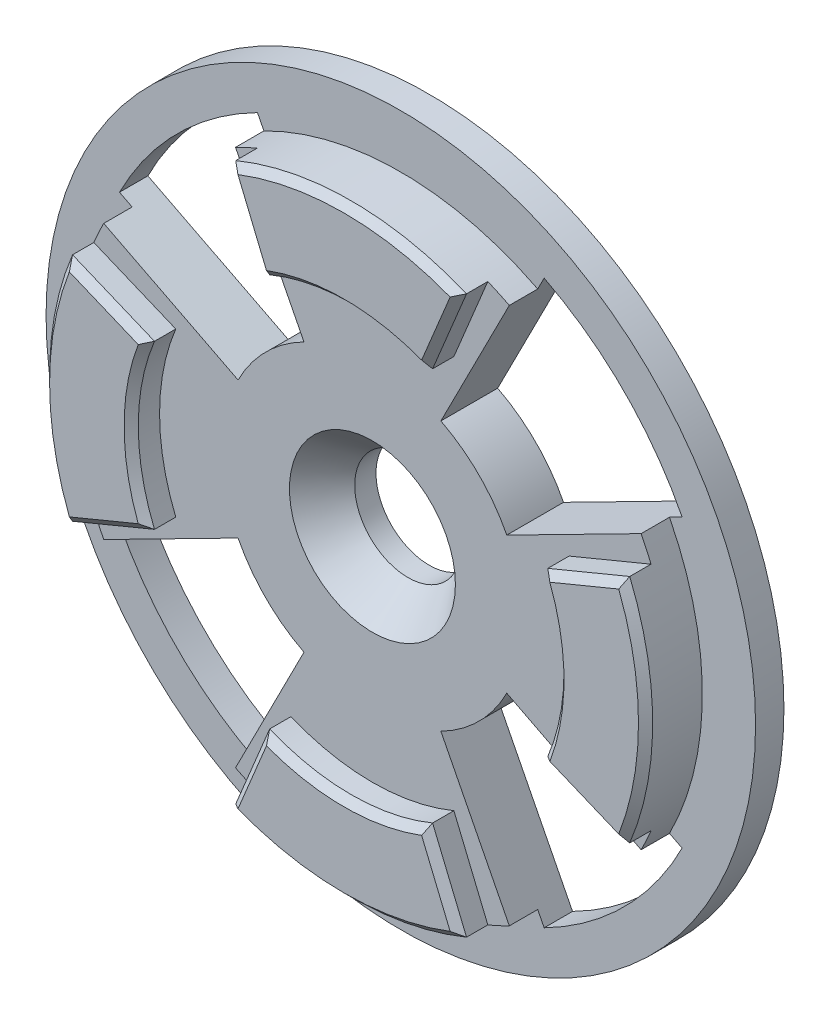
from build123d import *
from build123d.topology import SkipClean

# Parameters (mm, degrees)
SKETCH1_R                    = 10
BOSS_EXTRUDE1_DEPTH          = 0.8
SKETCH2_R                    = 1.1
CUT_EXTRUDE1_DEPTH           = 10
BOSS_EXTRUDE2_DEPTH          = 0.8
SKETCH4_R                    = 1.5
CUT_EXTRUDE2_DEPTH           = 10
CHAMFER1_SIZE                = 1
CHAMFER1_SIZE2               = 0.8391
SKETCH7_R                    = 1.1
BOSS_EXTRUDE3_DEPTH          = 0.8
BOSS_EXTRUDE4_DEPTH          = 0.8
CUT_EXTRUDE3_DEPTH           = 15.232357
CUT_EXTRUDE3_DEPTH_BACK      = 15.232357
SKETCH9_R                    = 0.755
CUT_EXTRUDE4_DEPTH           = 15.232357
CUT_EXTRUDE4_DEPTH_BACK      = 15.232357
SKETCH10_R                   = 1.5
CUT_EXTRUDE_THIN1_DEPTH      = 15.232357
CUT_EXTRUDE_THIN1_DEPTH_BACK = 0.8
BOSS_EXTRUDE5_DEPTH          = 0.8
SKETCH14_R                   = 0.755
CUT_EXTRUDE5_DEPTH           = 10
CHAMFER2_SIZE                = 0.2
CUT_EXTRUDE6_DEPTH           = 10


with BuildPart() as part:
    # Sketch1 → Boss-Extrude1 (new body)
    with BuildSketch(Plane.XY):
        Circle(SKETCH1_R)
    extrude(amount=BOSS_EXTRUDE1_DEPTH)

    # Sketch2 → Cut-Extrude1 (cut)
    with BuildSketch(Plane.XY.offset(0.8)):
        with Locations((0, -8)):
            Circle(SKETCH2_R)
    extrude(amount=-CUT_EXTRUDE1_DEPTH, mode=Mode.SUBTRACT)

    # Sketch3 → Boss-Extrude2 (add)
    with BuildSketch(Plane.XY.offset(0.8)):
        with BuildLine():
            ThreePointArc((1.097695, -8.428824), (0, 8.5), (-1.097695, -8.428824))
            ThreePointArc((-1.097695, -8.428824), (0, -6.821516), (1.097695, -8.428824))
        make_face()
    extrude(amount=BOSS_EXTRUDE2_DEPTH)

    # Sketch4 → Cut-Extrude2 (cut)
    with BuildSketch(Plane.XY.offset(1.6)):
        Circle(SKETCH4_R)
    extrude(amount=-CUT_EXTRUDE2_DEPTH, mode=Mode.SUBTRACT)

    # Chamfer1
    chamfer1_edges = [part.edges().sort_by_distance(p)[0] for p in [
        (-1.5, 0, 1.6),
    ]]
    chamfer1_side = [part.faces().sort_by_distance(p)[0] for p in [
        (-1.5, 0, 0.8),
    ]]
    chamfer(chamfer1_edges, length=CHAMFER1_SIZE, length2=CHAMFER1_SIZE2, reference=chamfer1_side[0])

    # Sketch7 → Boss-Extrude3 (add)
    with BuildSketch(Plane.XY.offset(0.8)):
        with Locations((0, -8)):
            Circle(SKETCH7_R)
    extrude(amount=-BOSS_EXTRUDE3_DEPTH)

    # Sketch8 → Boss-Extrude4 (add)
    with BuildSketch(Plane.XY.offset(0.8)):
        with BuildLine():
            ThreePointArc((1.097695, -8.428824), (0, -6.821516), (-1.097695, -8.428824))
            ThreePointArc((-1.097695, -8.428824), (0, -8.5), (1.097695, -8.428824))
        make_face()
    extrude(amount=BOSS_EXTRUDE4_DEPTH)

    # Sketch9 → Cut-Extrude3 (cut, two sides: drawn at the far end of the back side and taken through both)
    with BuildSketch(Plane.XY.offset(1.6).offset(-CUT_EXTRUDE3_DEPTH_BACK)):
        with Locations((-4.610336, -4.610336)):
            Circle(SKETCH9_R)
        with Locations((4.610336, 4.610336)):
            Circle(SKETCH9_R)
    extrude(amount=CUT_EXTRUDE3_DEPTH + CUT_EXTRUDE3_DEPTH_BACK, mode=Mode.SUBTRACT)

    # Sketch10 → Cut-Extrude4 (cut, two sides: drawn at the far end of the back side and taken through both)
    with BuildSketch(Plane.XY.offset(1.6).offset(-CUT_EXTRUDE4_DEPTH_BACK)):
        with Locations((4.610336, 4.610336)):
            Circle(SKETCH10_R)
    extrude(amount=CUT_EXTRUDE4_DEPTH + CUT_EXTRUDE4_DEPTH_BACK, mode=Mode.SUBTRACT)

    # Sketch11 → Cut-Extrude-Thin1 (cut, two sides: drawn at the far end of the back side and taken through both)
    with BuildSketch(Plane.XY.offset(1.6).offset(-CUT_EXTRUDE_THIN1_DEPTH_BACK)):
        Polygon((4.822468, 4.398204), (6.66735, 6.243086), (6.243086, 6.66735), (4.398204, 4.822468), align=None)
    extrude(amount=CUT_EXTRUDE_THIN1_DEPTH + CUT_EXTRUDE_THIN1_DEPTH_BACK, mode=Mode.SUBTRACT)

    # Sketch12 → Boss-Extrude5 (add)
    with SkipClean():  # the faces are left unmerged after this step: merging them gives an invalid solid
        with BuildSketch(Plane.XY.offset(1.6)):
            with BuildLine():
                Line((5.543277, 2.296101), (7.852976, 3.252809))
                ThreePointArc((7.852976, 3.252809), (8.5, 0), (7.852976, -3.252809))
                Line((7.852976, -3.252809), (5.543277, -2.296101))
                ThreePointArc((5.543277, -2.296101), (6, 0), (5.543277, 2.296101))
            make_face()
            with BuildLine():
                Line((2.296101, -5.543277), (3.252809, -7.852976))
                ThreePointArc((3.252809, -7.852976), (0, -8.5), (-3.252809, -7.852976))
                Line((-3.252809, -7.852976), (-2.296101, -5.543277))
                ThreePointArc((-2.296101, -5.543277), (0, -6), (2.296101, -5.543277))
            make_face()
            with BuildLine():
                Line((-5.543277, -2.296101), (-7.852976, -3.252809))
                ThreePointArc((-7.852976, -3.252809), (-8.5, 0), (-7.852976, 3.252809))
                Line((-7.852976, 3.252809), (-5.543277, 2.296101))
                ThreePointArc((-5.543277, 2.296101), (-6, 0), (-5.543277, -2.296101))
            make_face()
            with BuildLine():
                Line((-2.296101, 5.543277), (-3.252809, 7.852976))
                ThreePointArc((-3.252809, 7.852976), (0, 8.5), (3.252809, 7.852976))
                Line((3.252809, 7.852976), (2.296101, 5.543277))
                ThreePointArc((2.296101, 5.543277), (0, 6), (-2.296101, 5.543277))
            make_face()
        extrude(amount=BOSS_EXTRUDE5_DEPTH)

    # Sketch14 → Cut-Extrude5 (cut)
    with SkipClean():  # the faces are left unmerged after this step: merging them gives an invalid solid
        with BuildSketch(Plane.XY.offset(1.6)):
            with Locations((4.610336, -4.610336)):
                Circle(SKETCH14_R)
            with Locations((-4.610336, 4.610336)):
                Circle(SKETCH14_R)
        extrude(amount=-CUT_EXTRUDE5_DEPTH, mode=Mode.SUBTRACT)

    # Chamfer2
    chamfer2_edges = [part.edges().sort_by_distance(p)[0] for p in [
        (8.5, 0, 2.4),
        (6.698127, 2.774455, 2.4),
        (6, 0, 2.4),
        (6.698127, -2.774455, 2.4),
        (0, 8.5, 2.4),
        (-2.774455, 6.698127, 2.4),
        (0, 6, 2.4),
        (2.774455, 6.698127, 2.4),
        (-6, 0, 2.4),
        (-6.698127, 2.774455, 2.4),
        (-8.5, 0, 2.4),
        (-6.698127, -2.774455, 2.4),
        (0, -6, 2.4),
        (-2.774455, -6.698127, 2.4),
        (0, -8.5, 2.4),
        (2.774455, -6.698127, 2.4),
    ]]
    chamfer(chamfer2_edges, length=CHAMFER2_SIZE)

    # Sketch15 → Cut-Extrude6 (cut)
    with SkipClean():  # the faces are left unmerged after this step: merging them gives an invalid solid
        with BuildSketch(Plane.XY.offset(1.6)):
            with BuildLine():
                Line((-7.573555, -3.858919), (-3.786778, -1.92946))
                ThreePointArc((-3.786778, -1.92946), (-3.005204, -3.005204), (-1.92946, -3.786778))
                Line((-1.92946, -3.786778), (-3.858919, -7.573555))
                Line((-3.858919, -7.573555), (-4.040515, -7.929958))
                ThreePointArc((-4.040515, -7.929958), (-6.29325, -6.29325), (-7.929958, -4.040515))
                Line((-7.929958, -4.040515), (-7.573555, -3.858919))
            make_face()
            with BuildLine():
                Line((-7.573555, 3.858919), (-3.786778, 1.92946))
                ThreePointArc((-3.786778, 1.92946), (-3.005204, 3.005204), (-1.92946, 3.786778))
                Line((-1.92946, 3.786778), (-3.858919, 7.573555))
                Line((-3.858919, 7.573555), (-4.040515, 7.929958))
                ThreePointArc((-4.040515, 7.929958), (-6.29325, 6.29325), (-7.929958, 4.040515))
                Line((-7.929958, 4.040515), (-7.573555, 3.858919))
            make_face()
            with BuildLine():
                Line((3.858919, 7.573555), (1.92946, 3.786778))
                ThreePointArc((1.92946, 3.786778), (3.005204, 3.005204), (3.786778, 1.92946))
                Line((3.786778, 1.92946), (7.573555, 3.858919))
                Line((7.573555, 3.858919), (7.929958, 4.040515))
                ThreePointArc((7.929958, 4.040515), (6.29325, 6.29325), (4.040515, 7.929958))
                Line((4.040515, 7.929958), (3.858919, 7.573555))
            make_face()
            with BuildLine():
                Line((7.573555, -3.858919), (3.786778, -1.92946))
                ThreePointArc((3.786778, -1.92946), (3.005204, -3.005204), (1.92946, -3.786778))
                Line((1.92946, -3.786778), (3.858919, -7.573555))
                Line((3.858919, -7.573555), (4.040515, -7.929958))
                ThreePointArc((4.040515, -7.929958), (6.29325, -6.29325), (7.929958, -4.040515))
                Line((7.929958, -4.040515), (7.573555, -3.858919))
            make_face()
        extrude(amount=-CUT_EXTRUDE6_DEPTH, mode=Mode.SUBTRACT)


solid = part.part
